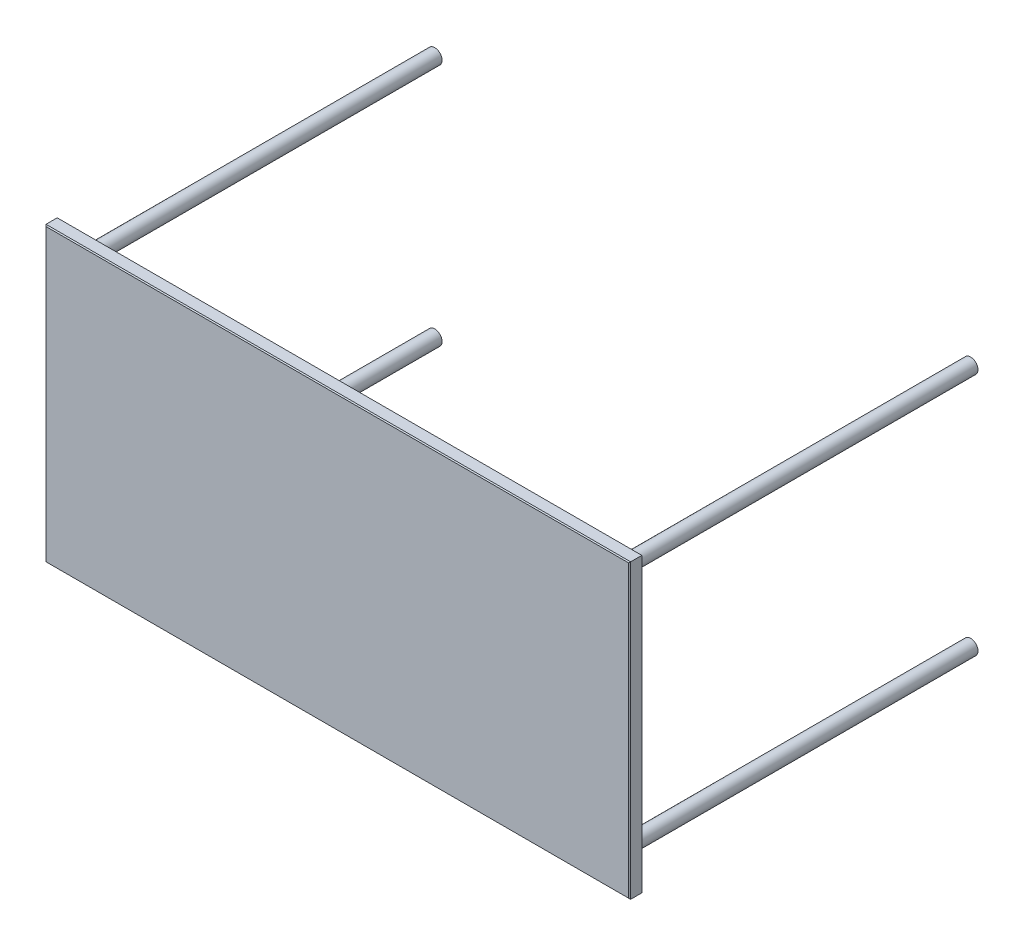
from build123d import *

# Parameters (mm, degrees)
SKETCH1_W           = 1200
SKETCH1_H           = 600
BOSS_EXTRUDE1_DEPTH = 25
SKETCH2_R           = 15
BOSS_EXTRUDE2_DEPTH = 725
CHAMFER1_SIZE       = 2


with BuildPart() as part:
    # Sketch1 → Boss-Extrude1 (new body)
    with BuildSketch(Plane.XY):
        Rectangle(SKETCH1_W, SKETCH1_H)
    extrude(amount=BOSS_EXTRUDE1_DEPTH)

    # Sketch2 → Boss-Extrude2 (add)
    with BuildSketch(Plane.XY):
        with Locations((550, 250)):
            Circle(SKETCH2_R)
        with Locations((-550, 250)):
            Circle(SKETCH2_R)
        with Locations((-550, -250)):
            Circle(SKETCH2_R)
        with Locations((550, -250)):
            Circle(SKETCH2_R)
    extrude(amount=-BOSS_EXTRUDE2_DEPTH)

    # Chamfer1
    chamfer1_edges = [part.edges().sort_by_distance(p)[0] for p in [
        (-600, 0, 25),
        (0, -300, 25),
        (600, 0, 25),
        (0, 300, 25),
    ]]
    chamfer(chamfer1_edges, length=CHAMFER1_SIZE)


solid = part.part
